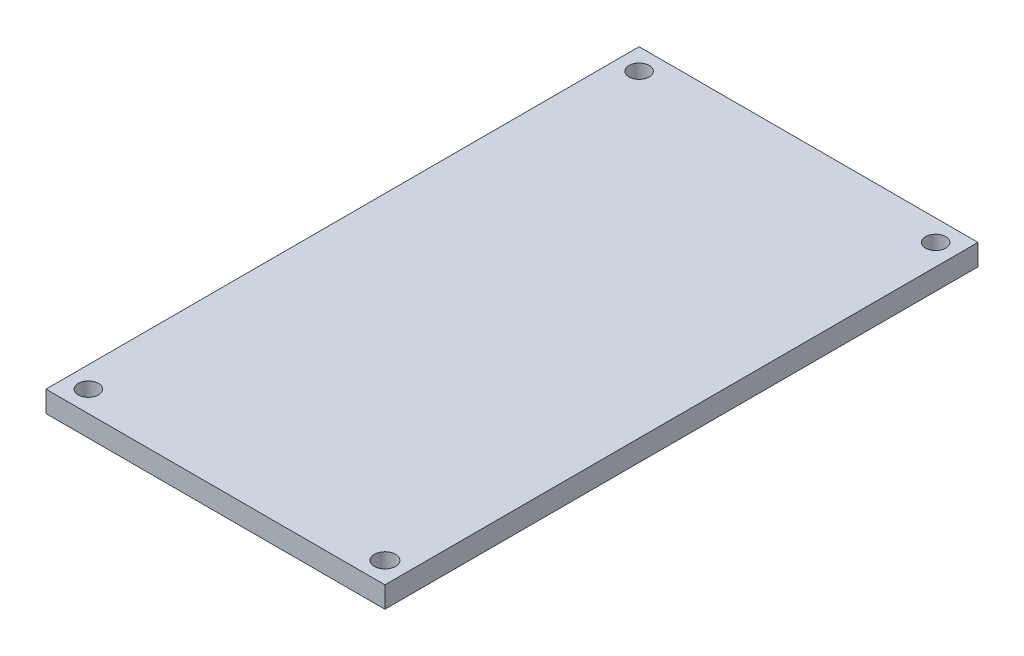
from build123d import *

# Parameters (mm, degrees)
SKETCH_2_W      = 32
SKETCH_2_H      = 56
SKETCH_2_R      = 0.95
SKETCH_2_R_2    = 1
EXTRUDE_2_DEPTH = 2


with BuildPart() as part:
    # 草图2 → 凸台-拉伸2 (new body)
    with BuildSketch(Plane(origin=(0, 0, 0), x_dir=(1, 0, 0), z_dir=(0, 1, 0))):
        Rectangle(SKETCH_2_W, SKETCH_2_H)
        with Locations(Location((-14, 26, 0), (0, 0, 270))):
            Circle(SKETCH_2_R, mode=Mode.SUBTRACT)
        with Locations(Location((14, 26, 0), (0, 0, 270))):
            Circle(SKETCH_2_R, mode=Mode.SUBTRACT)
        with Locations(Location((-14, -26, 0), (0, 0, 270))):
            Circle(SKETCH_2_R, mode=Mode.SUBTRACT)
        with Locations(Location((14, -26, 0), (0, 0, 270))):
            Circle(SKETCH_2_R_2, mode=Mode.SUBTRACT)
    extrude(amount=EXTRUDE_2_DEPTH)


solid = part.part
